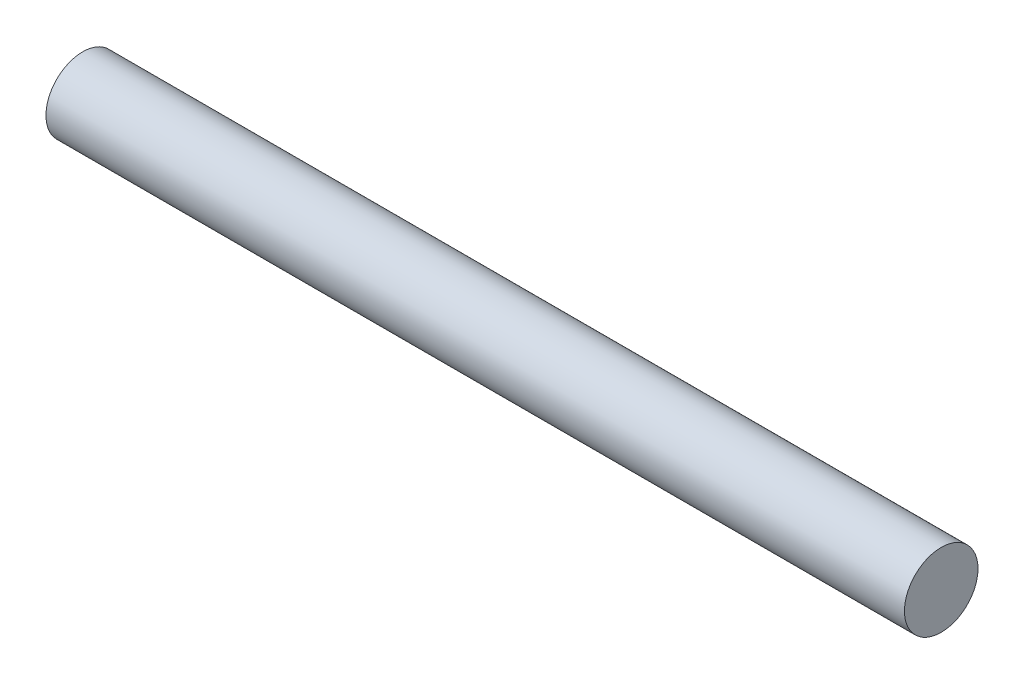
from build123d import *

# Parameters (mm, degrees)
SKETCH1_R           = 1.5
BOSS_EXTRUDE1_DEPTH = 35


with BuildPart() as part:
    # Sketch1 → Boss-Extrude1 (new body)
    with BuildSketch(Plane(origin=(0, 0, 0), x_dir=(0, 0, -1), z_dir=(1, 0, 0))):
        Circle(SKETCH1_R)
    extrude(amount=BOSS_EXTRUDE1_DEPTH)


solid = part.part
